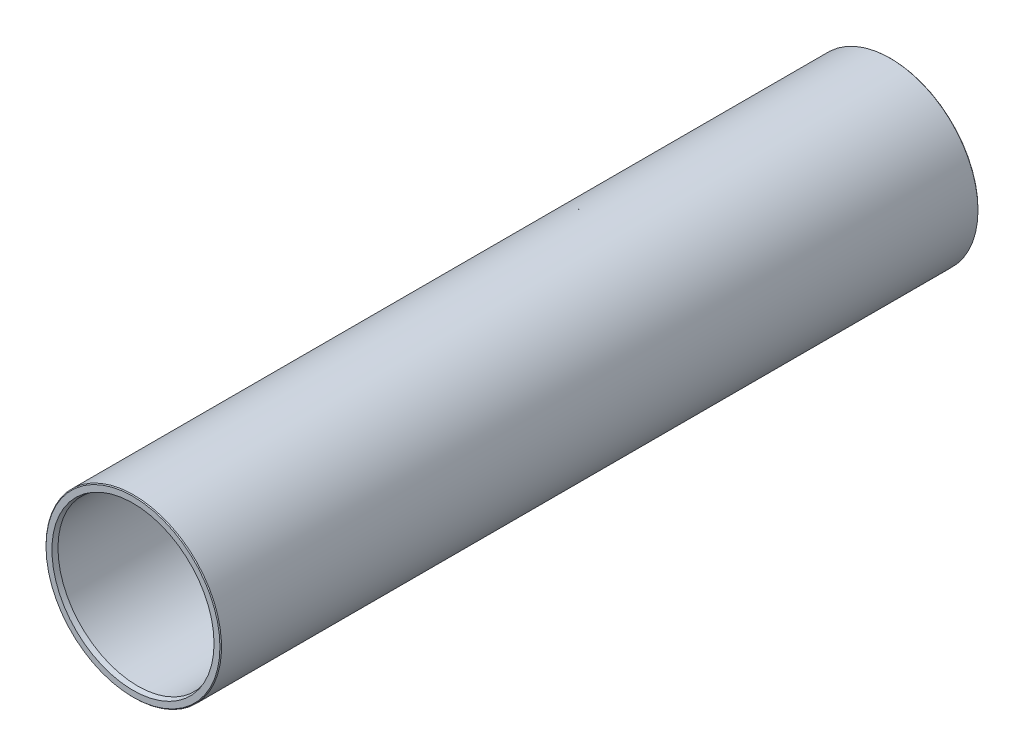
from build123d import *
from OCP.BRepFilletAPI import BRepFilletAPI_MakeChamfer

# Parameters (mm, degrees)
SKETCH1_R               = 55
SKETCH1_R_2             = 50
TUBE_BODY_DEPTH         = 237.5
BORESINK_LEADIN_SIZE    = 0.8
BORESINK_LEADIN_SIZE2   = 3
BORESINK_LEADIN_2_SIZE  = 0.8
BORESINK_LEADIN_2_SIZE2 = 3
OD_EDGE_BREAK_SIZE      = 0.5


with BuildPart() as part:
    # Sketch1 → Tube Body (new, symmetric)
    with BuildSketch(Plane.XY):
        with Locations(Location((0, 0, 0), (0, 0, 180))):
            Circle(SKETCH1_R)
        with Locations(Location((0, 0, 0), (0, 0, 180))):
            Circle(SKETCH1_R_2, mode=Mode.SUBTRACT)
    extrude(amount=TUBE_BODY_DEPTH, both=True)

    # Boresink_Leadin: one chamfer whose edges measure the first distance from different faces: ONE call of the kernel's chamfer builder (chamfer() names one face for all edges)
    boresink_leadin_edges_1 = [part.edges().sort_by_distance(p)[0] for p in [
        (50, 0, -237.5),
    ]]
    boresink_leadin_side_1 = [part.faces().sort_by_distance(p)[0] for p in [
        (50, 0, 0),
    ]]
    boresink_leadin_edges_2 = [part.edges().sort_by_distance(p)[0] for p in [
        (50, 0, 237.5),
    ]]
    boresink_leadin_side_2 = [part.faces().sort_by_distance(p)[0] for p in [
        (53.444365081, 0, 237.5),
    ]]
    boresink_leadin = BRepFilletAPI_MakeChamfer(part.part.solid().wrapped)
    for e in boresink_leadin_edges_1:
        boresink_leadin.Add(BORESINK_LEADIN_SIZE, BORESINK_LEADIN_SIZE2, e.wrapped, boresink_leadin_side_1[0].wrapped)  # the first distance lies on this face
    for e in boresink_leadin_edges_2:
        boresink_leadin.Add(BORESINK_LEADIN_SIZE, BORESINK_LEADIN_SIZE2, e.wrapped, boresink_leadin_side_2[0].wrapped)  # the first distance lies on this face
    add(Compound.cast(boresink_leadin.Shape()), mode=Mode.REPLACE)

    # Boresink_Leadin 2
    boresink_leadin_2_edges = [part.edges().sort_by_distance(p)[0] for p in [
        (50, 0, -236.7),
    ]]
    boresink_leadin_2_side = [part.faces().sort_by_distance(p)[0] for p in [
        (51.5, 0, -237.1),
    ]]
    chamfer(boresink_leadin_2_edges, length=BORESINK_LEADIN_2_SIZE, length2=BORESINK_LEADIN_2_SIZE2, reference=boresink_leadin_2_side[0])

    # OD_Edge_Break
    od_edge_break_edges = [part.edges().sort_by_distance(p)[0] for p in [
        (55, 0, -237.5),
        (55, 0, 237.5),
    ]]
    chamfer(od_edge_break_edges, length=OD_EDGE_BREAK_SIZE)


solid = part.part
